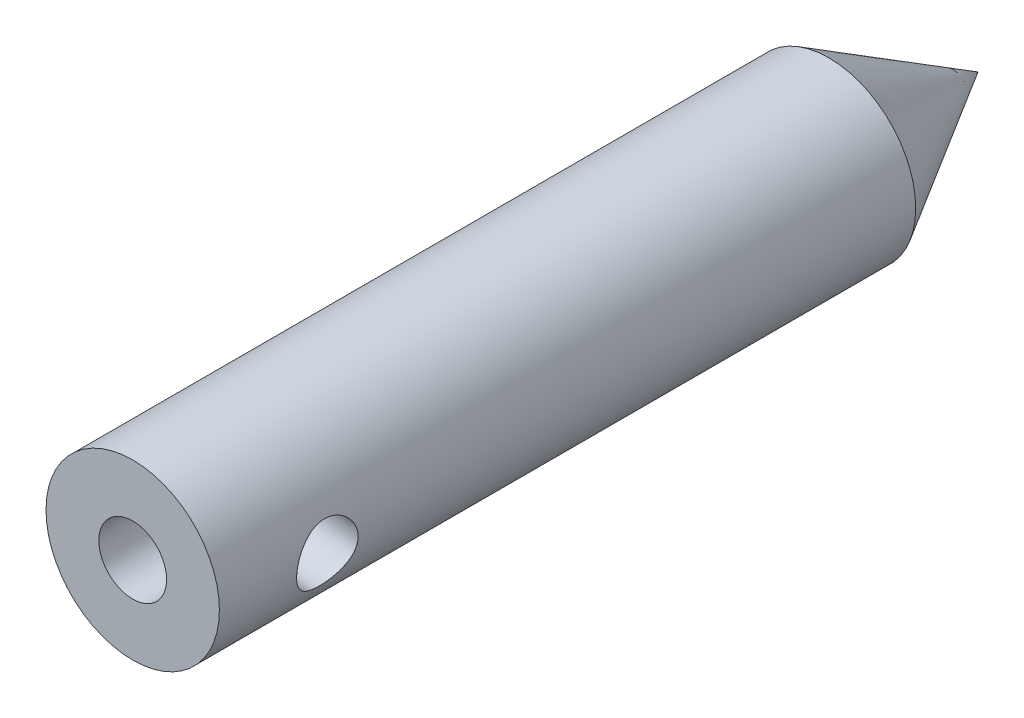
from build123d import *

# Parameters (mm, degrees)
SKETCH3_R                 = 3.2
BOSS_EXTRUDE2_DEPTH       = 25.7
CUT_EXTRUDE1_DEPTH        = 27.095401894
CUT_EXTRUDE1_DEPTH_BACK   = 25.7
SKETCH6_R                 = 1.25
TAP_DRILL_FOR_4_40_TAP1_D = 2.2606


with BuildPart() as part:
    # Sketch3 → Boss-Extrude2 (new body)
    with BuildSketch(Plane.XY):
        with Locations(Location((0, 0, 0), (0, 0, 180))):
            Circle(SKETCH3_R)
    extrude(amount=BOSS_EXTRUDE2_DEPTH)

    # Sketch6 → Cut-Extrude1 (cut, two sides: drawn at the far end of the back side and taken through both)
    with BuildSketch(Plane.XY.offset(25.7).offset(-CUT_EXTRUDE1_DEPTH_BACK)):
        with Locations(Location((0, 0, 0), (0, 0, 180))):
            Circle(SKETCH6_R)
    extrude(amount=CUT_EXTRUDE1_DEPTH + CUT_EXTRUDE1_DEPTH_BACK, mode=Mode.SUBTRACT)

    # Sketch7 → Revolve1 (revolve)
    with BuildSketch(Plane(origin=(0, 0, 0), x_dir=(1, 0, 0), z_dir=(0, 1, 0)), mode=Mode.PRIVATE) as revolve1_sk:
        Polygon((0, 0), (-3.2, 0), (0, 5.5), align=None)
    revolve(revolve1_sk.sketch.rotate(Axis((0, 0, -5.5), (0, 0, 1)), 180), axis=Axis((0, 0, -5.5), (0, 0, 1)))

    # Tap Drill for #4-40 Tap1 (through all)
    with Locations(Plane(origin=(3.187528357, -0.282246299, 21.7), x_dir=(0.088201968553, 0.996102611553, 0), z_dir=(0.996102611553, -0.088201968553, 0))):
        with Locations((0, 0)):
            Hole(TAP_DRILL_FOR_4_40_TAP1_D / 2)


solid = part.part
